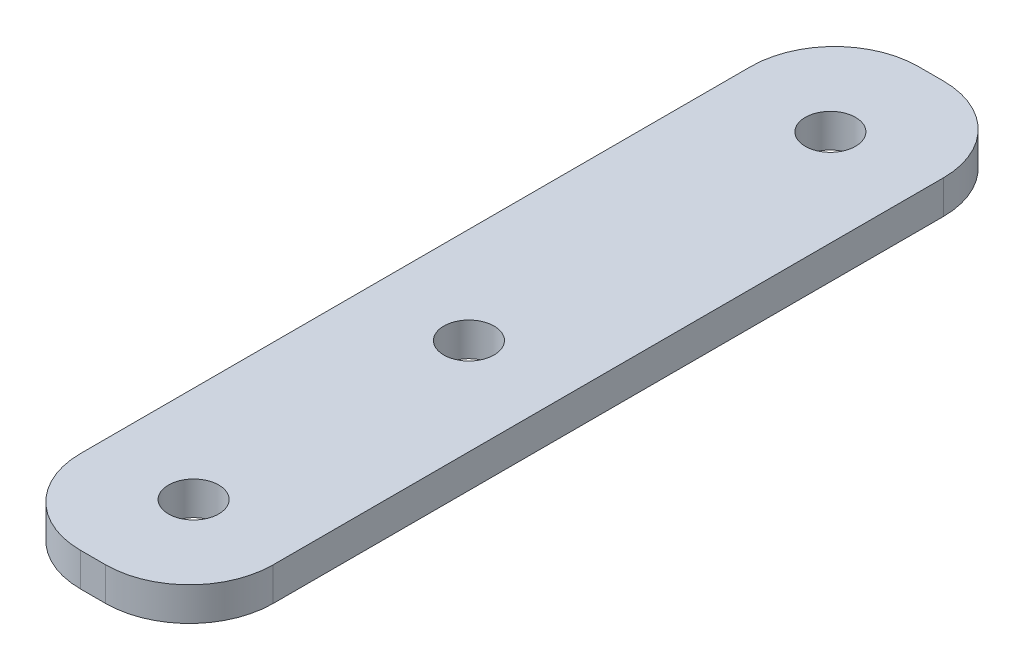
from build123d import *

# Parameters (mm, degrees)
ESQUISSE1_W             = 11.5
ESQUISSE1_H             = 2
EXTRU_MINCE1_DEPTH      = 50
ESQUISSE2_R             = 1.5
ENL_V_MAT_EXTRU_1_DEPTH = 3
CONG_1_R                = 5


with BuildPart() as part:
    # Esquisse1 → Extru.-Mince1 (new body)
    with BuildSketch(Plane.XY):
        with Locations((5.75, 1)):
            Rectangle(ESQUISSE1_W, ESQUISSE1_H)
    extrude(amount=EXTRU_MINCE1_DEPTH)

    # Esquisse2 → Enlèv. mat.-Extru.1 (cut)
    with BuildSketch(Plane(origin=(0, 2, 0), x_dir=(1, 0, 0), z_dir=(0, 1, 0))):
        with Locations(Location((5.75, -6, 0), (0, 0, 270))):
            Circle(ESQUISSE2_R)
        with Locations(Location((5.75, -27.56965461, 0), (0, 0, 270))):
            Circle(ESQUISSE2_R)
        with Locations(Location((5.75, -44, 0), (0, 0, 270))):
            Circle(ESQUISSE2_R)
    extrude(amount=-ENL_V_MAT_EXTRU_1_DEPTH, mode=Mode.SUBTRACT)

    # Congé1
    cong_1_edges = [part.edges().sort_by_distance(p)[0] for p in [
        (0, 1, 50),
        (0, 1, 0),
        (11.5, 1, 0),
        (11.5, 1, 50),
    ]]
    fillet(cong_1_edges, radius=CONG_1_R)


solid = part.part
